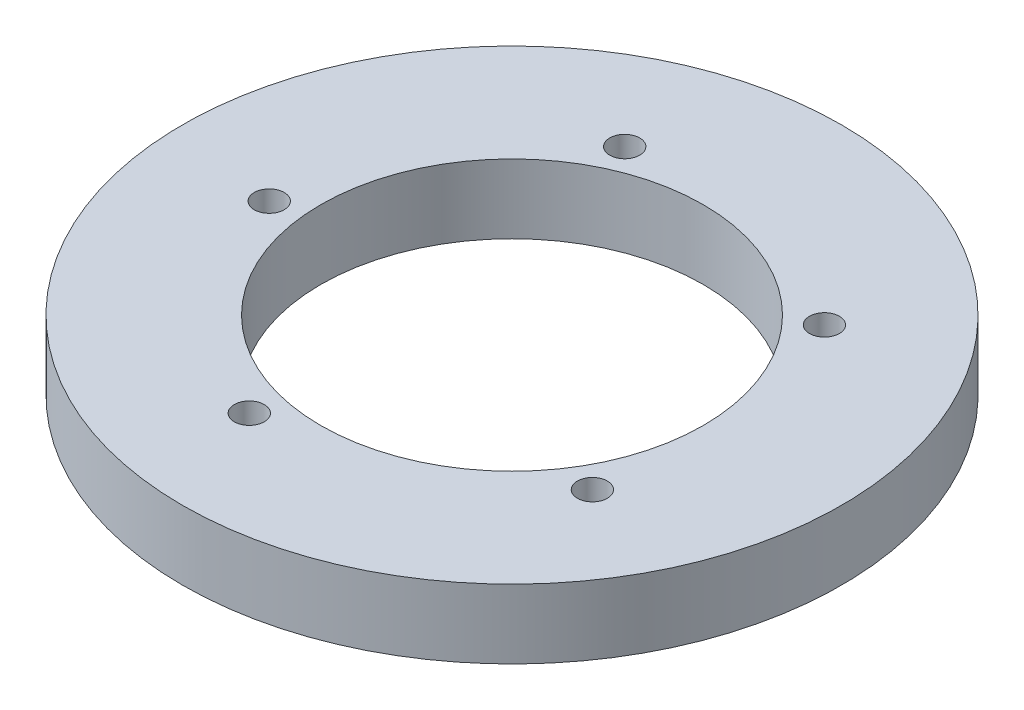
from build123d import *

# Parameters (mm, degrees)
SKETCH1_R           = 71.5
SKETCH1_R_2         = 41.5
SKETCH1_R_3         = 3.25
BOSS_EXTRUDE1_DEPTH = 15


with BuildPart() as part:
    # Sketch1 → Boss-Extrude1 (new body)
    with BuildSketch(Plane(origin=(0, 0, 0), x_dir=(1, 0, 0), z_dir=(0, 1, 0))):
        with Locations(Location((-1.336232833, 19.905228099, 0), (0, 0, 270))):
            Circle(SKETCH1_R)
        with Locations(Location((-1.336232833, 19.905228099, 0), (0, 0, 270))):
            Circle(SKETCH1_R_2, mode=Mode.SUBTRACT)
        with Locations(Location((40.185857772, -4.176216869, 0), (0, 0, 270))):
            Circle(SKETCH1_R_3, mode=Mode.SUBTRACT)
        with Locations(Location((34.397613964, 51.953507196, 0), (0, 0, 270))):
            Circle(SKETCH1_R_3, mode=Mode.SUBTRACT)
        with Locations(Location((-20.773591569, 63.793598829, 0), (0, 0, 270))):
            Circle(SKETCH1_R_3, mode=Mode.SUBTRACT)
        with Locations(Location((-49.083027981, 14.981453825, 0), (0, 0, 270))):
            Circle(SKETCH1_R_3, mode=Mode.SUBTRACT)
        with Locations(Location((-11.408016353, -27.026202486, 0), (0, 0, 270))):
            Circle(SKETCH1_R_3, mode=Mode.SUBTRACT)
    extrude(amount=BOSS_EXTRUDE1_DEPTH)


solid = part.part
